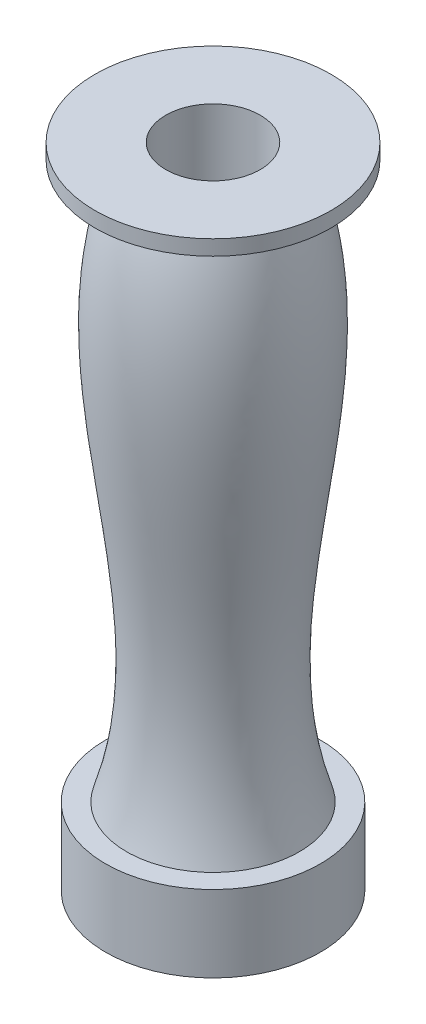
from build123d import *


with BuildPart() as part:
    # Sketch1 → Revolve1 (revolve)
    with BuildSketch(Plane.XY):
        with BuildLine():
            Line((0, 0), (-20, 0))
            Line((-20, 0), (-22.73384679, 0))
            Line((-22.73384679, 0), (-22.73384679, 16.220495926))
            Line((-22.73384679, 16.220495926), (-18.300134272, 16.220495926))
            add(Edge.make_bspline(
                [(-18.300134272, 16.220495926), (-5.670504473, 55.673452295), (-30.161473098, 94.429907861), (-15, 133.958018926)],
                knots=[0, 0, 0, 0, 1, 1, 1, 1], degree=3))
            Line((-15, 133.958018926), (-25, 133.958018926))
            Line((-25, 133.958018926), (-25, 137.165116337))
            Line((-25, 137.165116337), (-10, 137.165116337))
            Line((-10, 137.165116337), (-10, 12.132026435))
            Line((-10, 12.132026435), (-15.065390894, 12.132026435))
            Line((-15.065390894, 12.132026435), (-15.065390894, 2.062870175))
            Line((-15.065390894, 2.062870175), (0, 2.062870175))
            Line((0, 2.062870175), (0, 0))
        make_face()
    revolve(axis=Axis((0, 150, 0), (0, -1, 0)))


solid = part.part
